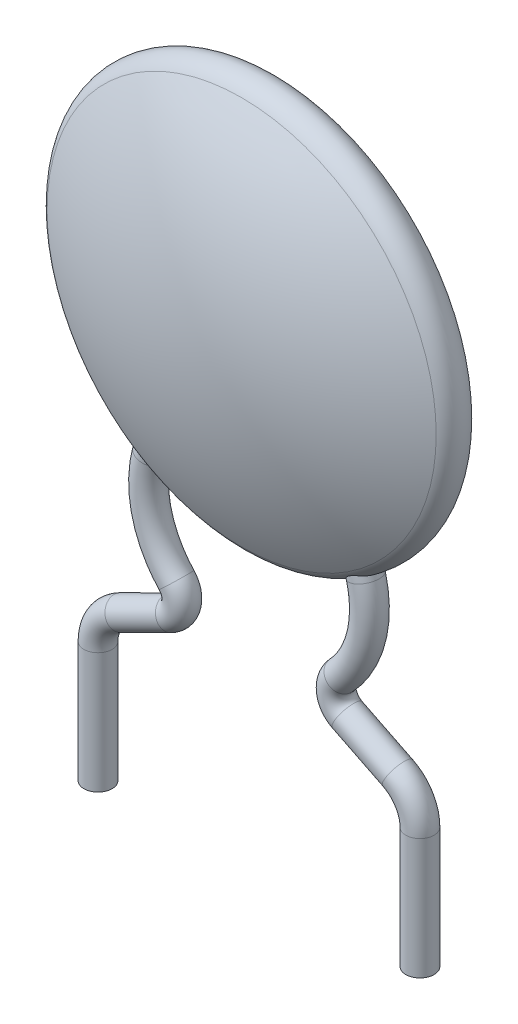
from build123d import *
from build123d.topology import SkipClean

# Parameters (mm, degrees)
SKETCH_2_R = 0.35


with BuildPart() as part:
    # Эскиз1 → Повернуть7 (revolve)
    with BuildSketch(Plane(origin=(0, 0, 0), x_dir=(1, 0, 0), z_dir=(0, 1, 0)), mode=Mode.PRIVATE) as revolve_7_sk:
        with BuildLine():
            Line((0, 1.75), (0, -1.75))
            ThreePointArc((0, -1.75), (-2.505691012, -1.414251392), (-4.83460226, -0.430693069))
            ThreePointArc((-4.83460226, -0.430693069), (-5.080626907, 0), (-4.83460226, 0.430693069))
            ThreePointArc((-4.83460226, 0.430693069), (-2.505691012, 1.414251392), (0, 1.75))
        make_face()
    revolve(revolve_7_sk.sketch.rotate(Axis((0, 0, 0.721443958), (0, 0, -1)), 180), axis=Axis((0, 0, 0.721443958), (0, 0, -1)))

    # По траектории1: sweep along a path in Эскиз3
    with SkipClean():  # the faces are left unmerged after this step: merging them gives an invalid solid
        with BuildLine(Plane.XY) as sweep_1_path:
            Line((2, 0), (2, -1.821368611))
            ThreePointArc((2, -1.821368611), (2.008964461, -1.954967113), (2.03569712, -2.086170339))
            Line((2.03569712, -2.086170339), (2.652717062, -4.333112271))
            ThreePointArc((2.652717062, -4.333112271), (2.670228198, -5.63815247), (2.049381784, -6.78618831))
            ThreePointArc((2.049381784, -6.78618831), (1.92513675, -7.210003279), (2.190708351, -7.562888078))
            Line((2.190708351, -7.562888078), (3.444390038, -8.184793499))
            ThreePointArc((3.444390038, -8.184793499), (3.849820581, -8.553554823), (4, -9.080626907))
            Line((4, -9.080626907), (4, -12.080626907))
        # Эскиз2 → По траектории1 (sweep)
        with BuildSketch(Plane(origin=(0, 0, 0), x_dir=(1, 0, 0), z_dir=(0, 1, 0))):
            with Locations((2, 0)):
                Circle(SKETCH_2_R)
        sweep_1 = sweep(path=sweep_1_path.line)

    # Зеркальное отражение1: По траектории1 across plane
    with SkipClean():  # the faces are left unmerged after this step: merging them gives an invalid solid
        add(sweep_1.mirror(Plane(origin=(0, 0, 0), x_dir=(0, 0, 1), z_dir=(1, 0, 0))))


solid = part.part
